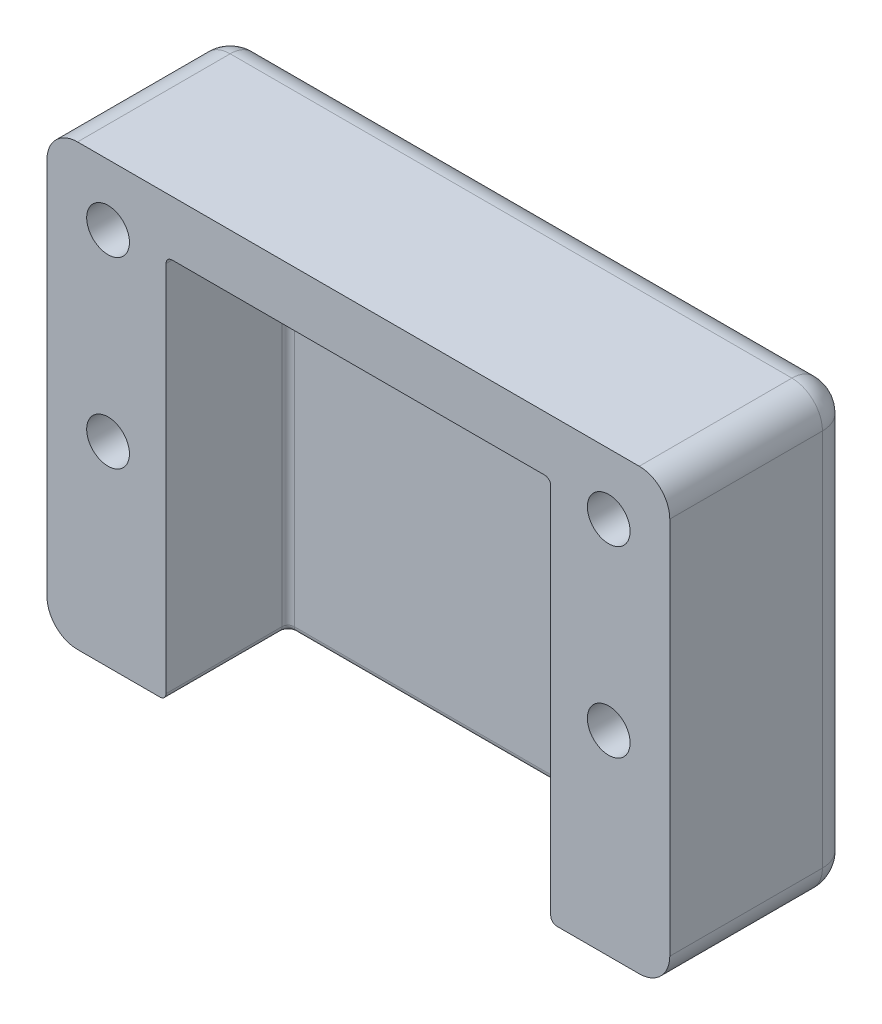
from build123d import *

# Parameters (mm, degrees)
SKETCH1_W           = 51
SKETCH1_H           = 36
BOSS_EXTRUDE1_DEPTH = 15
SKETCH2_W           = 31.5
SKETCH2_H           = 31.5
CUT_EXTRUDE1_DEPTH  = 10
SKETCH3_R           = 1.75
CUT_EXTRUDE2_DEPTH  = 65.202803677
FILLET1_R           = 0.5
FILLET2_R           = 2.5


with BuildPart() as part:
    # Sketch1 → Boss-Extrude1 (new body)
    with BuildSketch(Plane.XY):
        with Locations((25.5, 18)):
            Rectangle(SKETCH1_W, SKETCH1_H)
    extrude(amount=BOSS_EXTRUDE1_DEPTH)

    # Sketch2 → Cut-Extrude1 (cut)
    with BuildSketch(Plane.XY.offset(15)):
        with Locations((25.5, 15.75)):
            Rectangle(SKETCH2_W, SKETCH2_H)
    extrude(amount=-CUT_EXTRUDE1_DEPTH, mode=Mode.SUBTRACT)

    # Sketch3 → Cut-Extrude2 (cut, through all)
    with BuildSketch(Plane.XY.offset(15)):
        with Locations((5, 31)):
            Circle(SKETCH3_R)
        with Locations((5, 16)):
            Circle(SKETCH3_R)
        with Locations((46, 31)):
            Circle(SKETCH3_R)
        with Locations((46, 16)):
            Circle(SKETCH3_R)
    extrude(amount=-CUT_EXTRUDE2_DEPTH, mode=Mode.SUBTRACT)

    # Fillet1
    fillet1_edges = [part.edges().sort_by_distance(p)[0] for p in [
        (25.5, 0, 5),
        (41.25, 0, 10),
        (9.75, 15.75, 5),
        (9.75, 0, 10),
        (25.5, 31.5, 5),
        (9.75, 31.5, 10),
        (41.25, 15.75, 5),
        (41.25, 31.5, 10),
    ]]
    fillet(fillet1_edges, radius=FILLET1_R)

    # Fillet2
    fillet2_edges = [part.edges().sort_by_distance(p)[0] for p in [
        (25.5, 36, 0),
        (51, 18, 0),
        (25.5, 0, 0),
        (0, 18, 0),
        (0, 36, 7.5),
        (51, 36, 7.5),
        (51, 0, 7.5),
        (0, 0, 7.5),
    ]]
    fillet(fillet2_edges, radius=FILLET2_R)


solid = part.part
